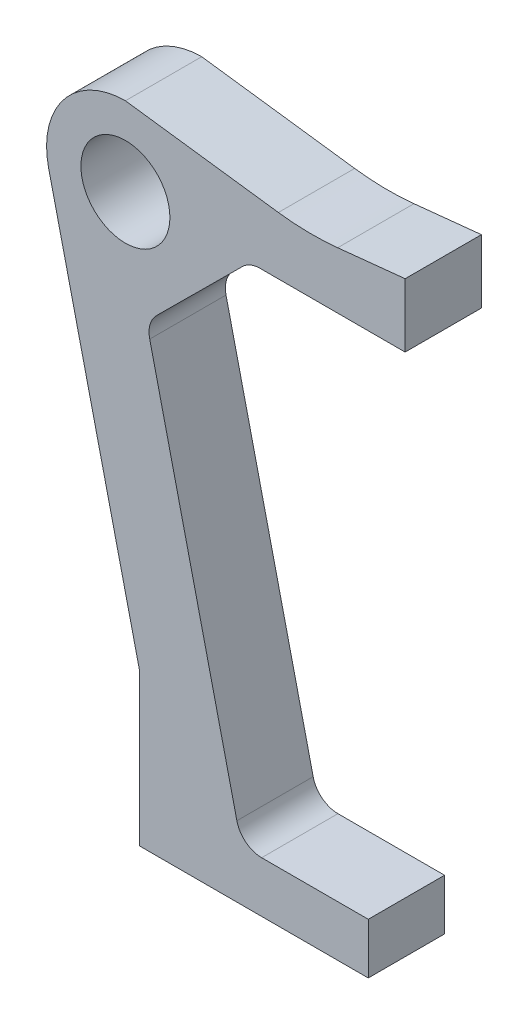
from build123d import *

# Parameters (mm, degrees)
BOSS_EXTRU_1_START = 0.2
ESQUISSE1_R        = 1.75
BOSS_EXTRU_1_DEPTH = 3


with BuildPart() as part:
    # Esquisse1 → Boss.-Extru.1 (new body)
    with BuildSketch(Plane.XY.offset(BOSS_EXTRU_1_START)):
        with BuildLine():
            Line((0.981089506, 13.370599952), (4.55, -1.925))
            Line((4.55, -1.925), (4.55, -7.925))
            Line((4.55, -7.925), (13.55, -7.925))
            Line((13.55, -7.925), (13.55, -5.925))
            Line((13.55, -5.925), (9.357429757, -5.925))
            ThreePointArc((9.357429757, -5.925), (8.735829332, -5.708334482), (8.383587662, -5.152225822))
            Line((8.383587662, -5.152225822), (4.956202513, 9.536826262))
            ThreePointArc((4.956202513, 9.536826262), (4.968859947, 10.039957952), (5.224987097, 10.473202214))
            Line((5.224987097, 10.473202214), (8.596002843, 13.824763284))
            ThreePointArc((8.596002843, 13.824763284), (8.91971414, 14.040045447), (9.301060354, 14.115613154))
            Line((9.301060354, 14.115613154), (15, 14.115613154))
            Line((15, 14.115613154), (15, 16.615613154))
            Line((15, 16.615613154), (12.347446948, 16.343800746))
            ThreePointArc((12.347446948, 16.343800746), (11.180211538, 16.29280118), (10.014994386, 16.378290639))
            Line((10.014994386, 16.378290639), (4, 17.175))
            ThreePointArc((4, 17.175), (1.571663105, 16.001961319), (0.981089506, 13.370599952))
        make_face()
        with Locations((4, 14.075)):
            Circle(ESQUISSE1_R, mode=Mode.SUBTRACT)
    extrude(amount=BOSS_EXTRU_1_DEPTH)


solid = part.part
